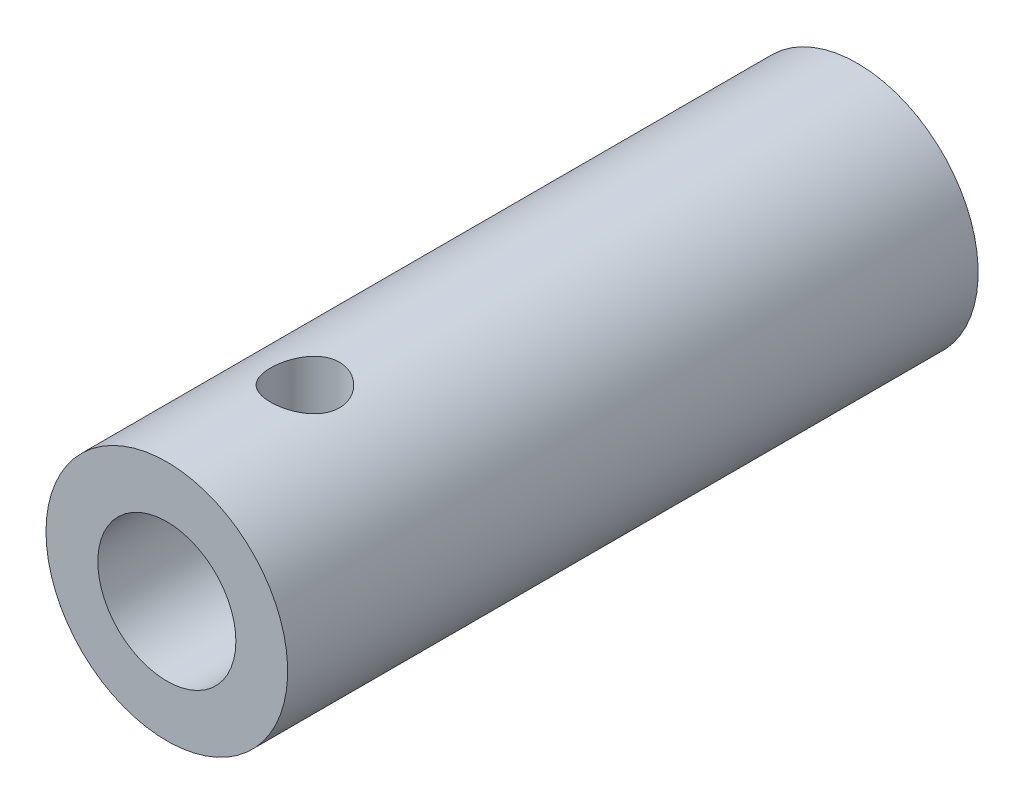
from build123d import *

# Parameters (mm, degrees)
SKETCH1_W                     = 7
SKETCH1_H                     = 40
F_8_0_8_DIAMETER_HOLE1_D      = 8
F_4_0_4_DIAMETER_HOLE1_REACH  = 37.623
F_4_0_4_DIAMETER_HOLE1_BORE_R = 2


with BuildPart() as part:
    # Sketch1 → Revolve1 (revolve)
    with BuildSketch(Plane.XZ, mode=Mode.PRIVATE) as revolve1_sk:
        with Locations((3.5, 20)):
            Rectangle(SKETCH1_W, SKETCH1_H)
    revolve(revolve1_sk.sketch.rotate(Axis((0, 0, 40), (0, 0, -1)), 180), axis=Axis((0, 0, 40), (0, 0, -1)))

    # Ø8.0 (8) Diameter Hole1 (through all)
    with Locations(Plane.XY.offset(40)):
        with Locations((0, 0)):
            Hole(F_8_0_8_DIAMETER_HOLE1_D / 2)

    # Ø4.0 (4) Diameter Hole1 bore (on position points) → Ø4.0 (4) Diameter Hole1 (cut, up to next)
    with BuildSketch(Plane(origin=(0, 7, 32), x_dir=(1, 0, 0), z_dir=(0, 1, 0)), mode=Mode.PRIVATE) as f_4_0_4_diameter_hole1_sk1:
        Circle(F_4_0_4_DIAMETER_HOLE1_BORE_R)
    f_4_0_4_diameter_hole1_tool1 = extrude(f_4_0_4_diameter_hole1_sk1.sketch, amount=-F_4_0_4_DIAMETER_HOLE1_REACH, mode=Mode.PRIVATE) & part.part
    add(f_4_0_4_diameter_hole1_tool1.solids().sort_by_distance((0, 7, 32))[0], mode=Mode.SUBTRACT)


solid = part.part
